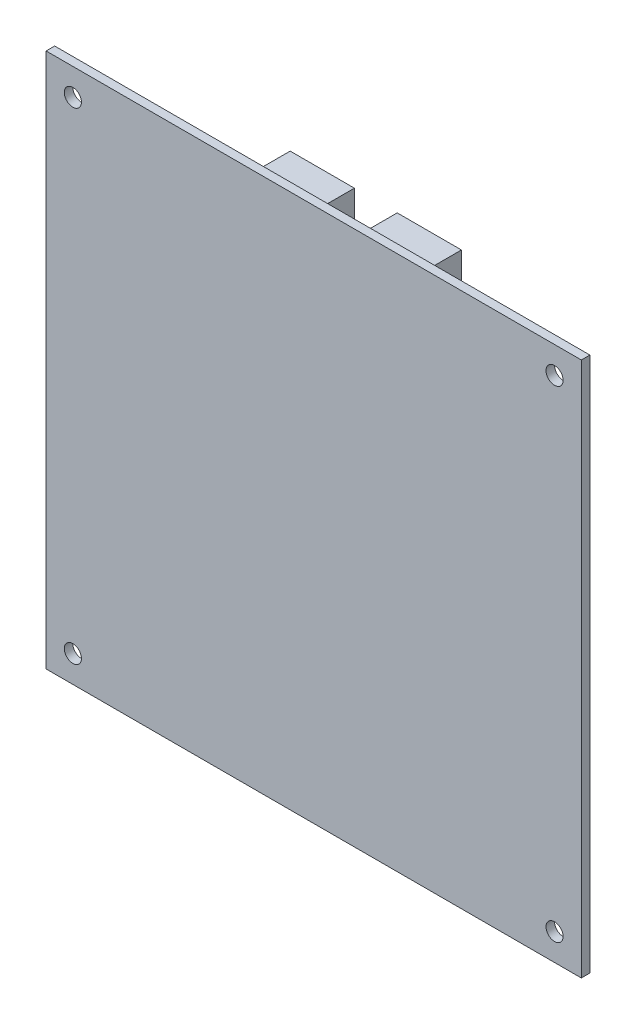
from build123d import *

# Parameters (mm, degrees)
SKETCH_1_W          = 100
SKETCH_1_H          = 100
SKETCH_1_R          = 1.6
F_100X100_1P6_DEPTH = 1.6
EXTRUDE_START       = -8
SKETCH_2_W          = 4
SKETCH_2_H          = 58
EXTRUDE_280_DEPTH   = 8
SKETCH_3_W          = 4
SKETCH_3_H          = 58
EXTRUDE_353_DEPTH   = 8
EXTRUDE_START_2     = -16
SKETCH_4_W          = 32
SKETCH_4_H          = 47
EXTRUDE_423_DEPTH   = 16
EXTRUDE_START_3     = -12
SKETCH_5_W          = 20
SKETCH_5_H          = 10
EXTRUDE_493_DEPTH   = 12
EXTRUDE_START_4     = -10
SKETCH_6_W          = 12
SKETCH_6_H          = 10
EXTRUDE_563_DEPTH   = 10
SKETCH_7_W          = 12
SKETCH_7_H          = 10
EXTRUDE_633_DEPTH   = 10


with BuildPart() as part:
    # 草图1 → 100x100_板厚1p6 (new body)
    with BuildSketch(Plane.XY):
        with Locations((50, 50)):
            Rectangle(SKETCH_1_W, SKETCH_1_H)
        with Locations((5, 5)):
            Circle(SKETCH_1_R, mode=Mode.SUBTRACT)
        with Locations((95, 5)):
            Circle(SKETCH_1_R, mode=Mode.SUBTRACT)
        with Locations((5, 95)):
            Circle(SKETCH_1_R, mode=Mode.SUBTRACT)
        with Locations((95, 95)):
            Circle(SKETCH_1_R, mode=Mode.SUBTRACT)
    extrude(amount=F_100X100_1P6_DEPTH)

    # 草图2 → Extrude 280 (add)
    with BuildSketch(Plane.XY.offset(EXTRUDE_START)):
        with Locations((28, 49)):
            Rectangle(SKETCH_2_W, SKETCH_2_H)
    extrude(amount=EXTRUDE_280_DEPTH)

    # 草图3 → Extrude 353 (add)
    with BuildSketch(Plane.XY.offset(EXTRUDE_START)):
        with Locations((72, 49)):
            Rectangle(SKETCH_3_W, SKETCH_3_H)
    extrude(amount=EXTRUDE_353_DEPTH)

    # 草图4 → Extrude 423 (add)
    with BuildSketch(Plane.XY.offset(EXTRUDE_START_2)):
        with Locations((50, 49.5)):
            Rectangle(SKETCH_4_W, SKETCH_4_H)
    extrude(amount=EXTRUDE_423_DEPTH)

    # 草图5 → Extrude 493 (add)
    with BuildSketch(Plane.XY.offset(EXTRUDE_START_3)):
        with Locations((50, 8)):
            Rectangle(SKETCH_5_W, SKETCH_5_H)
    extrude(amount=EXTRUDE_493_DEPTH)

    # 草图6 → Extrude 563 (add)
    with BuildSketch(Plane.XY.offset(EXTRUDE_START_4)):
        with Locations((40, 90)):
            Rectangle(SKETCH_6_W, SKETCH_6_H)
    extrude(amount=EXTRUDE_563_DEPTH)

    # 草图7 → Extrude 633 (add)
    with BuildSketch(Plane.XY.offset(EXTRUDE_START_4)):
        with Locations((60, 90)):
            Rectangle(SKETCH_7_W, SKETCH_7_H)
    extrude(amount=EXTRUDE_633_DEPTH)


solid = part.part
